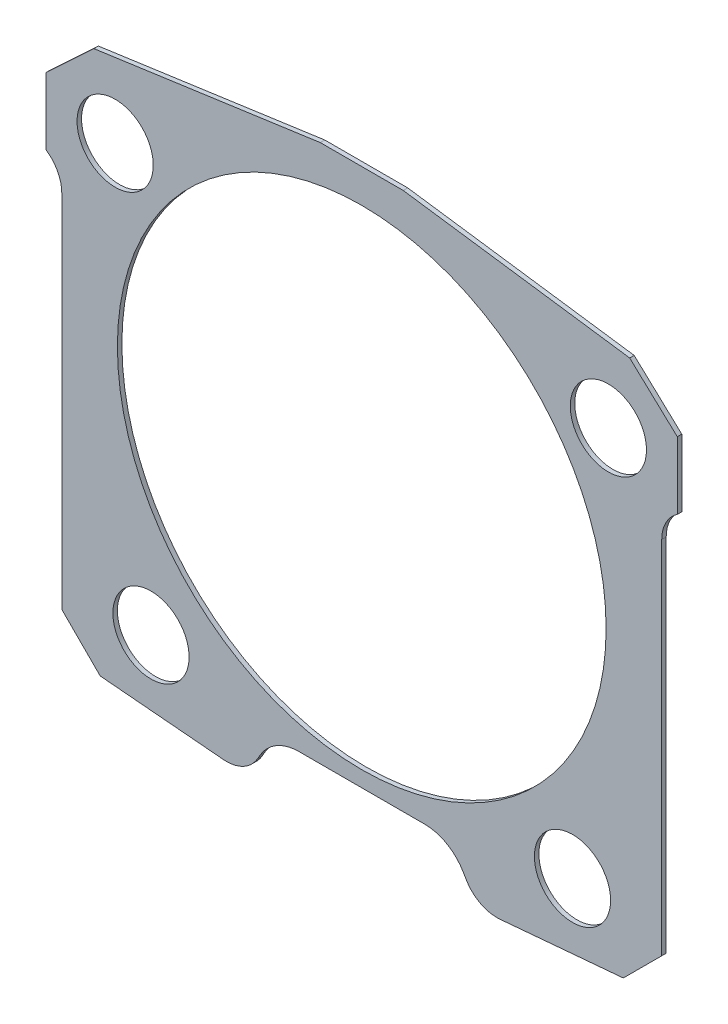
from build123d import *

# Parameters (mm, degrees)
SKETCH1_R           = 54.5
SKETCH1_R_2         = 8.5
BOSS_EXTRUDE1_DEPTH = 1


with BuildPart() as part:
    # Sketch1 → Boss-Extrude1 (new body)
    with BuildSketch(Plane.XY):
        with BuildLine():
            Line((-9.25, 62), (9.25, 62))
            Line((9.25, 62), (59.753671506, 54.902171851))
            Line((59.753671506, 54.902171851), (70.375, 44.997622795))
            Line((70.375, 44.997622795), (70.375, 30))
            ThreePointArc((70.375, 30), (67.821864652, 27.130969792), (66.9, 23.402699416))
            Line((66.9, 23.402699416), (66.9, -57))
            Line((66.9, -57), (58.333823358, -65.566176642))
            Line((58.333823358, -65.566176642), (30.863053479, -67.969557585))
            ThreePointArc((30.863053479, -67.969557585), (26.471818631, -67.096086665), (23.237604307, -64))
            Line((23.237604307, -64), (22.660254038, -63))
            ThreePointArc((22.660254038, -63), (19, -59.339745962), (14, -58))
            Line((14, -58), (-14, -58))
            ThreePointArc((-14, -58), (-19, -59.339745962), (-22.660254038, -63))
            Line((-22.660254038, -63), (-23.237604307, -64))
            ThreePointArc((-23.237604307, -64), (-26.471818631, -67.096086665), (-30.863053479, -67.969557585))
            Line((-30.863053479, -67.969557585), (-58.333823358, -65.566176642))
            Line((-58.333823358, -65.566176642), (-66.9, -57))
            Line((-66.9, -57), (-66.9, 23.402699416))
            ThreePointArc((-66.9, 23.402699416), (-67.821864652, 27.130969792), (-70.375, 30))
            Line((-70.375, 30), (-70.375, 44.997622795))
            Line((-70.375, 44.997622795), (-59.753671506, 54.902171851))
            Line((-59.753671506, 54.902171851), (-9.25, 62))
        make_face()
        Circle(SKETCH1_R, mode=Mode.SUBTRACT)
        with Locations((55, 39)):
            Circle(SKETCH1_R_2, mode=Mode.SUBTRACT)
        with Locations(Location((-55, 39, 0), (0, 0, 180))):
            Circle(SKETCH1_R_2, mode=Mode.SUBTRACT)
        with Locations((47, -52)):
            Circle(SKETCH1_R_2, mode=Mode.SUBTRACT)
        with Locations(Location((-47, -52, 0), (0, 0, 180))):
            Circle(SKETCH1_R_2, mode=Mode.SUBTRACT)
    extrude(amount=BOSS_EXTRUDE1_DEPTH)


solid = part.part
